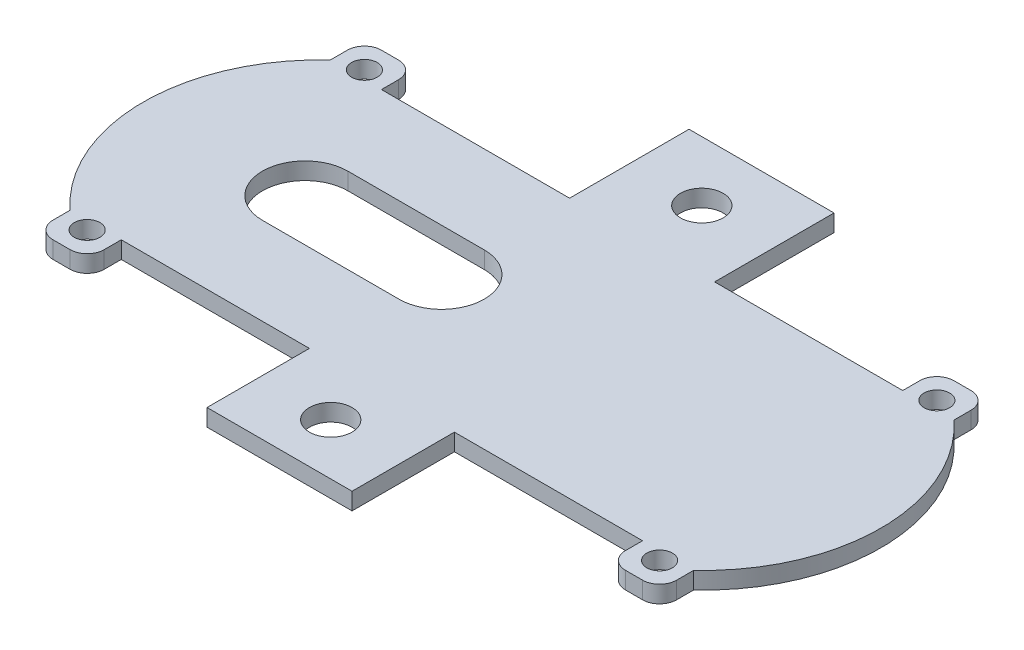
from build123d import *

# Parameters (mm, degrees)
SKETCH1_R           = 1.5
BOSS_EXTRUDE1_DEPTH = 2
CUT_EXTRUDE1_DEPTH  = 2
FILLET1_R           = 2
SKETCH3_R           = 2.5
CUT_EXTRUDE2_DEPTH  = 10


with BuildPart() as part:
    # Sketch1 → Boss-Extrude1 (new body)
    with BuildSketch(Plane(origin=(0, 0, 0), x_dir=(1, 0, 0), z_dir=(0, 1, 0))):
        with BuildLine():
            Line((8.64173402, -21.920230415), (8.64173402, -9.920230415))
            Line((8.64173402, -9.920230415), (30.694037343, -9.920230415))
            Line((30.694037343, -9.920230415), (30.694037343, -13.920230415))
            Line((30.694037343, -13.920230415), (36.694037343, -13.920230415))
            Line((36.694037343, -13.920230415), (36.694037343, -9.920230415))
            ThreePointArc((36.694037343, -9.920230415), (43.39173402, 5.329769585), (36.694037343, 20.579769585))
            Line((36.694037343, 20.579769585), (36.694037343, 24.579769585))
            Line((36.694037343, 24.579769585), (30.694037343, 24.579769585))
            Line((30.694037343, 24.579769585), (30.694037343, 20.579769585))
            Line((30.694037343, 20.579769585), (8.64173402, 20.579769585))
            Line((8.64173402, 20.579769585), (8.64173402, 34.579769585))
            Line((8.64173402, 34.579769585), (-8.35826598, 34.579769585))
            Line((-8.35826598, 34.579769585), (-8.35826598, 20.579769585))
            Line((-8.35826598, 20.579769585), (-30.410569302, 20.579769585))
            Line((-30.410569302, 20.579769585), (-30.410569302, 24.579769585))
            Line((-30.410569302, 24.579769585), (-36.410569302, 24.579769585))
            Line((-36.410569302, 24.579769585), (-36.410569302, 20.579769585))
            ThreePointArc((-36.410569302, 20.579769585), (-43.10826598, 5.329769585), (-36.410569302, -9.920230415))
            Line((-36.410569302, -9.920230415), (-36.410569302, -13.920230415))
            Line((-36.410569302, -13.920230415), (-30.410569302, -13.920230415))
            Line((-30.410569302, -13.920230415), (-30.410569302, -9.920230415))
            Line((-30.410569302, -9.920230415), (-8.35826598, -9.920230415))
            Line((-8.35826598, -9.920230415), (-8.35826598, -21.920230415))
            Line((-8.35826598, -21.920230415), (8.64173402, -21.920230415))
        make_face()
        with Locations(Location((-33.410569302, 21.579769585, 0), (0, 0, 270))):
            Circle(SKETCH1_R, mode=Mode.SUBTRACT)
        with Locations(Location((-33.410569302, -10.920230415, 0), (0, 0, 270))):
            Circle(SKETCH1_R, mode=Mode.SUBTRACT)
        with Locations(Location((33.694037343, -10.920230415, 0), (0, 0, 270))):
            Circle(SKETCH1_R, mode=Mode.SUBTRACT)
        with Locations(Location((33.694037343, 21.579769585, 0), (0, 0, 270))):
            Circle(SKETCH1_R, mode=Mode.SUBTRACT)
    extrude(amount=BOSS_EXTRUDE1_DEPTH)

    # Sketch2 → Cut-Extrude1 (cut)
    with BuildSketch(Plane(origin=(0, 2, 0), x_dir=(1, 0, 0), z_dir=(0, 1, 0))):
        with BuildLine():
            Line((-24.10826598, 10.329769585), (-8.10826598, 10.329769585))
            ThreePointArc((-8.10826598, 10.329769585), (-3.10826598, 5.329769585), (-8.10826598, 0.329769585))
            Line((-8.10826598, 0.329769585), (-24.10826598, 0.329769585))
            ThreePointArc((-24.10826598, 0.329769585), (-29.10826598, 5.329769585), (-24.10826598, 10.329769585))
        make_face()
    extrude(amount=-CUT_EXTRUDE1_DEPTH, mode=Mode.SUBTRACT)

    # Fillet1
    fillet1_edges = [part.edges().sort_by_distance(p)[0] for p in [
        (-30.410569302, 1, 13.920230415),
        (-36.410569302, 1, 13.920230415),
        (-36.410569302, 1, -24.579769585),
        (-30.410569302, 1, -24.579769585),
        (30.694037343, 1, -24.579769585),
        (36.694037343, 1, -24.579769585),
        (36.694037343, 1, 13.920230415),
        (30.694037343, 1, 13.920230415),
    ]]
    fillet(fillet1_edges, radius=FILLET1_R)

    # Sketch3 → Cut-Extrude2 (cut)
    with BuildSketch(Plane.XZ):
        with Locations(Location((0.14173402, -27.579769585, 0), (0, 0, 270))):
            Circle(SKETCH3_R)
        with Locations(Location((0.14173402, 15.920230415, 0), (0, 0, 270))):
            Circle(SKETCH3_R)
    extrude(amount=-CUT_EXTRUDE2_DEPTH, mode=Mode.SUBTRACT)


solid = part.part
